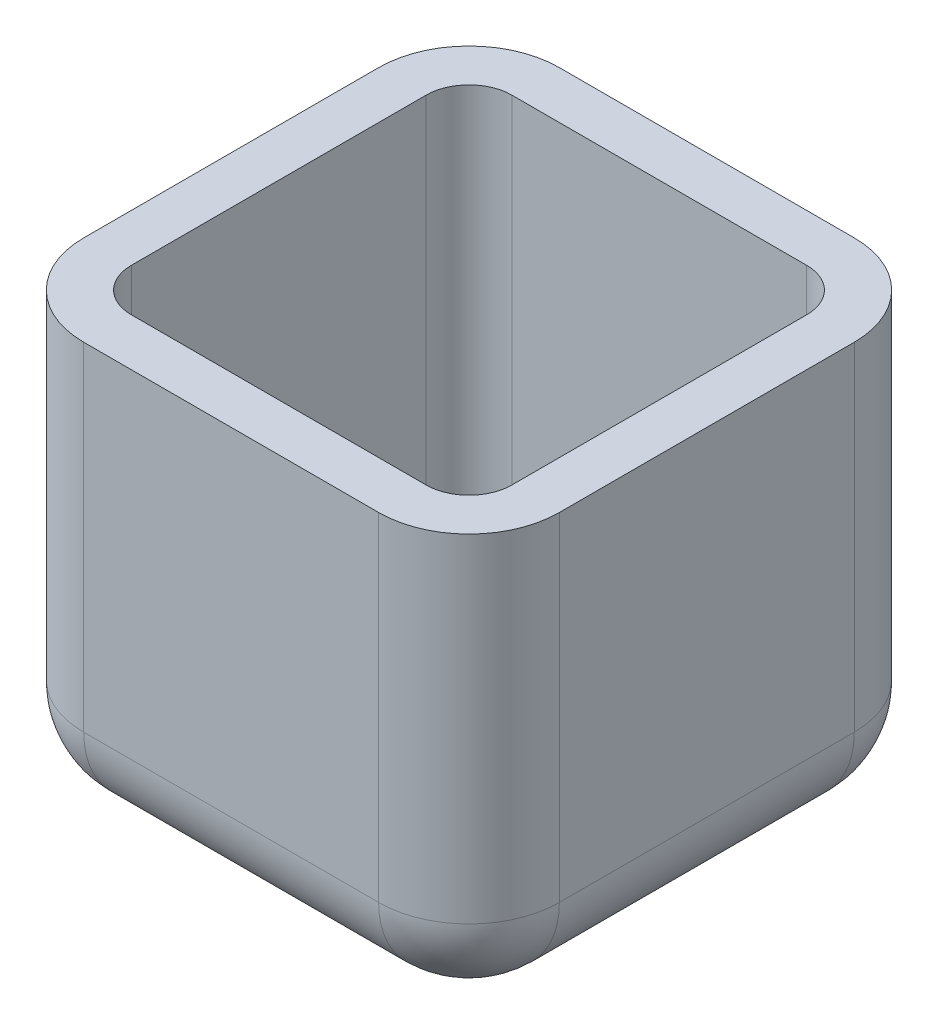
from build123d import *

# Parameters (mm, degrees)
SKETCH1_W           = 50
SKETCH1_H           = 50
BOSS_EXTRUDE1_DEPTH = 45
SHELL1_T            = -5
FILLET1_R           = 4.5
FILLET2_R           = 9.5


with BuildPart() as part:
    # Sketch1 → Boss-Extrude1 (new body)
    with BuildSketch(Plane(origin=(0, 0, 0), x_dir=(1, 0, 0), z_dir=(0, 1, 0))):
        Rectangle(SKETCH1_W, SKETCH1_H)
    extrude(amount=BOSS_EXTRUDE1_DEPTH)

    # Shell1
    shell1_openings = [part.faces().sort_by_distance(p)[0] for p in [
        (0, 45, 0),
    ]]
    offset(amount=SHELL1_T, openings=shell1_openings, kind=Kind.INTERSECTION)

    # Fillet1
    fillet1_edges = [part.edges().sort_by_distance(p)[0] for p in [
        (20, 25, 20),
        (20, 25, -20),
        (-20, 25, -20),
        (-20, 25, 20),
    ]]
    fillet(fillet1_edges, radius=FILLET1_R)

    # Fillet2
    fillet2_edges = [part.edges().sort_by_distance(p)[0] for p in [
        (0, 0, 25),
        (-25, 0, 0),
        (0, 0, -25),
        (25, 0, 0),
        (25, 22.5, 25),
        (-25, 22.5, 25),
        (-25, 22.5, -25),
        (25, 22.5, -25),
    ]]
    fillet(fillet2_edges, radius=FILLET2_R)


solid = part.part
